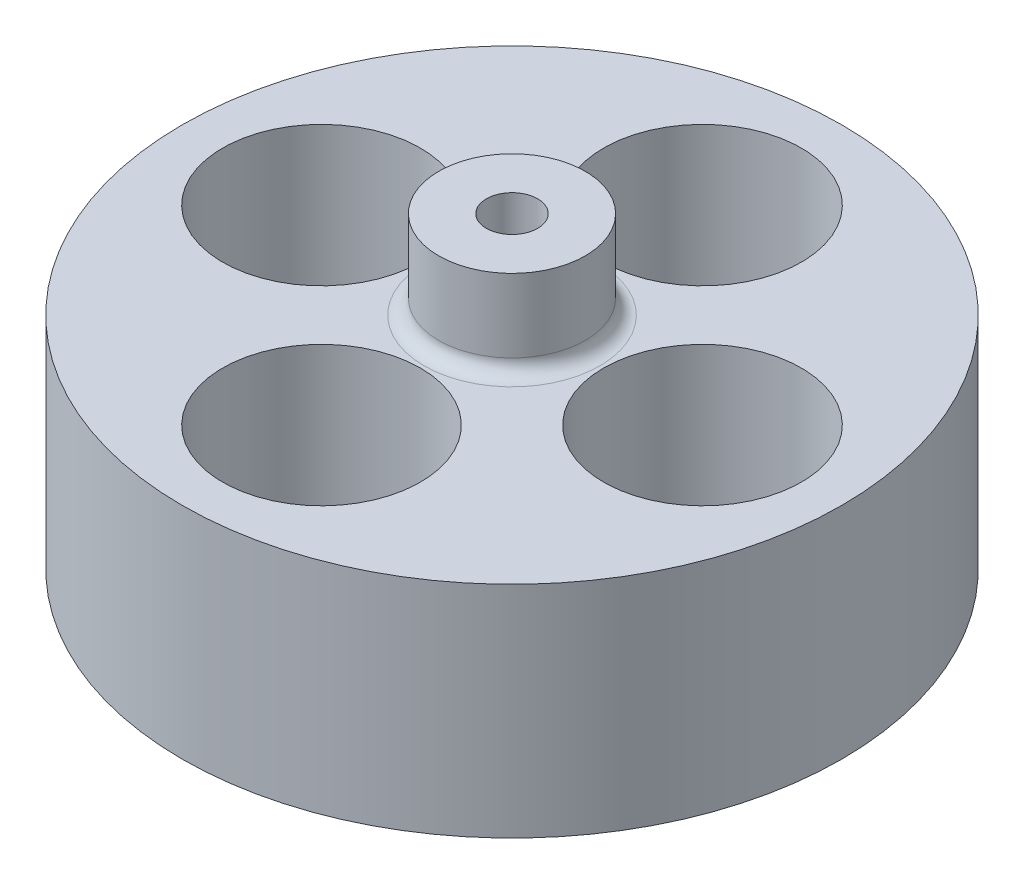
from build123d import *

# Parameters (mm, degrees)
SKETCH1_R           = 22.5
BOSS_EXTRUDE1_DEPTH = 15
SKETCH2_R           = 6.75
CUT_EXTRUDE1_DEPTH  = 10
SKETCH3_R           = 2
CUT_EXTRUDE2_DEPTH  = 35
CIRPATTERN1_COUNT   = 4
SKETCH6_R           = 1.75
CUT_EXTRUDE4_DEPTH  = 45
BOSS_EXTRUDE2_START = 6
SKETCH7_R           = 5
SKETCH7_R_2         = 1.75
BOSS_EXTRUDE2_DEPTH = 6
FILLET1_R           = 1
SKETCH8_R           = 3.5
CUT_EXTRUDE5_DEPTH  = 5


with BuildPart() as part:
    # Sketch1 → Boss-Extrude1 (new body)
    with BuildSketch(Plane(origin=(0, 0, 0), x_dir=(1, 0, 0), z_dir=(0, 1, 0))):
        with Locations(Location((0, 0, 0), (0, 0, 270))):
            Circle(SKETCH1_R)
    extrude(amount=BOSS_EXTRUDE1_DEPTH)

    # Sketch2 → Cut-Extrude1 (cut)
    with BuildSketch(Plane(origin=(0, 15, 0), x_dir=(1, 0, 0), z_dir=(0, 1, 0))):
        with Locations(Location((0, 13, 0), (0, 0, 270))):
            Circle(SKETCH2_R)
    cut_extrude1 = extrude(amount=-CUT_EXTRUDE1_DEPTH, mode=Mode.SUBTRACT)

    # Sketch3 → Cut-Extrude2 (cut)
    with BuildSketch(Plane(origin=(0, 5, 0), x_dir=(1, 0, 0), z_dir=(0, 1, 0))):
        with Locations(Location((0, 13, 0), (0, 0, 270))):
            Circle(SKETCH3_R)
    cut_extrude2 = extrude(amount=-CUT_EXTRUDE2_DEPTH, mode=Mode.SUBTRACT)

    # CirPattern1: Cut-Extrude1, Cut-Extrude2 ×4 about axis
    cirpattern1_axis = Axis((0, 0, 0), (0, 1, 0))
    add([cut_extrude1.rotate(cirpattern1_axis, i * 360 / CIRPATTERN1_COUNT) for i in range(1, CIRPATTERN1_COUNT)], mode=Mode.SUBTRACT)
    add([cut_extrude2.rotate(cirpattern1_axis, i * 360 / CIRPATTERN1_COUNT) for i in range(1, CIRPATTERN1_COUNT)], mode=Mode.SUBTRACT)

    # Sketch6 → Cut-Extrude4 (cut)
    with BuildSketch(Plane(origin=(0, 15, 0), x_dir=(1, 0, 0), z_dir=(0, 1, 0))):
        with Locations(Location((0, 0, 0), (0, 0, 270))):
            Circle(SKETCH6_R)
    extrude(amount=-CUT_EXTRUDE4_DEPTH, mode=Mode.SUBTRACT)

    # Sketch7 → Boss-Extrude2 (add)
    with BuildSketch(Plane(origin=(0, 15, 0), x_dir=(1, 0, 0), z_dir=(0, 1, 0)).offset(BOSS_EXTRUDE2_START)):
        with Locations(Location((0, 0, 0), (0, 0, 270))):
            Circle(SKETCH7_R)
        with Locations(Location((0, 0, 0), (0, 0, 270))):
            Circle(SKETCH7_R_2, mode=Mode.SUBTRACT)
    extrude(amount=-BOSS_EXTRUDE2_DEPTH)

    # Fillet1
    fillet1_edges = [part.edges().sort_by_distance(p)[0] for p in [
        (0, 15, -5),
    ]]
    fillet(fillet1_edges, radius=FILLET1_R)

    # Sketch8 → Cut-Extrude5 (cut)
    with BuildSketch(Plane.XZ):
        with Locations(Location((0, 0, 0), (0, 0, 270))):
            Circle(SKETCH8_R)
    extrude(amount=-CUT_EXTRUDE5_DEPTH, mode=Mode.SUBTRACT)


solid = part.part
